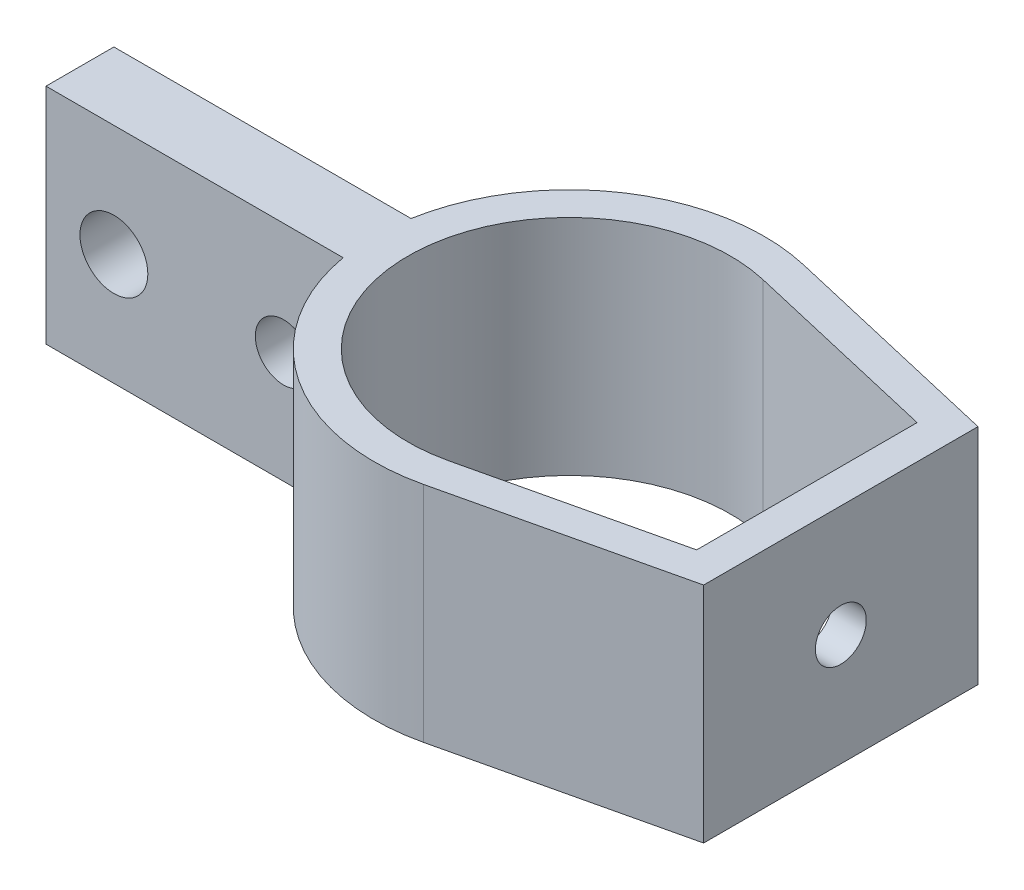
from build123d import *

# Parameters (mm, degrees)
BOSS_EXTRUDE1_DEPTH = 10.033
SKETCH2_R           = 3.048
SKETCH2_R_2         = 2.54
CUT_EXTRUDE1_DEPTH  = 10.033
SKETCH3_R           = 2.286
CUT_EXTRUDE2_DEPTH  = 10.033


with BuildPart() as part:
    # Sketch1 → Boss-Extrude1 (new, symmetric)
    with BuildSketch(Plane(origin=(0, 0, 0), x_dir=(1, 0, 0), z_dir=(0, 1, 0))):
        with BuildLine():
            Line((24.384, -12.319), (24.384, 12.319))
            Line((24.384, 12.319), (3.973043901, 17.069727536))
            ThreePointArc((3.973043901, 17.069727536), (-9.658201012, 14.624630908), (-17.258921519, 3.048))
            Line((-17.258921519, 3.048), (-43.942, 3.048))
            Line((-43.942, 3.048), (-43.942, -3.048))
            Line((-43.942, -3.048), (-17.258921519, -3.048))
            ThreePointArc((-17.258921519, -3.048), (-9.658201012, -14.624630908), (3.973043901, -17.069727536))
            Line((3.973043901, -17.069727536), (24.384, -12.319))
        make_face()
        with BuildLine():
            Line((21.336, -9.898960775), (21.336, 9.898960775))
            Line((21.336, 9.898960775), (3.282079744, 14.101079269))
            ThreePointArc((3.282079744, 14.101079269), (-14.478, 0), (3.282079744, -14.101079269))
            Line((3.282079744, -14.101079269), (21.336, -9.898960775))
        make_face(mode=Mode.SUBTRACT)
    extrude(amount=BOSS_EXTRUDE1_DEPTH, both=True)

    # Sketch2 → Cut-Extrude1 (cut, symmetric)
    with BuildSketch(Plane.XY.offset(3.048)):
        with Locations((-37.846, 0)):
            Circle(SKETCH2_R)
        with Locations((-22.606, 0)):
            Circle(SKETCH2_R_2)
    extrude(amount=CUT_EXTRUDE1_DEPTH, both=True, mode=Mode.SUBTRACT)

    # Sketch3 → Cut-Extrude2 (cut, symmetric)
    with BuildSketch(Plane(origin=(24.384, 0, 0), x_dir=(0, 0, -1), z_dir=(1, 0, 0))):
        with Locations(Location((0, 0, 0), (0, 0, 180))):
            Circle(SKETCH3_R)
    extrude(amount=CUT_EXTRUDE2_DEPTH, both=True, mode=Mode.SUBTRACT)


solid = part.part
